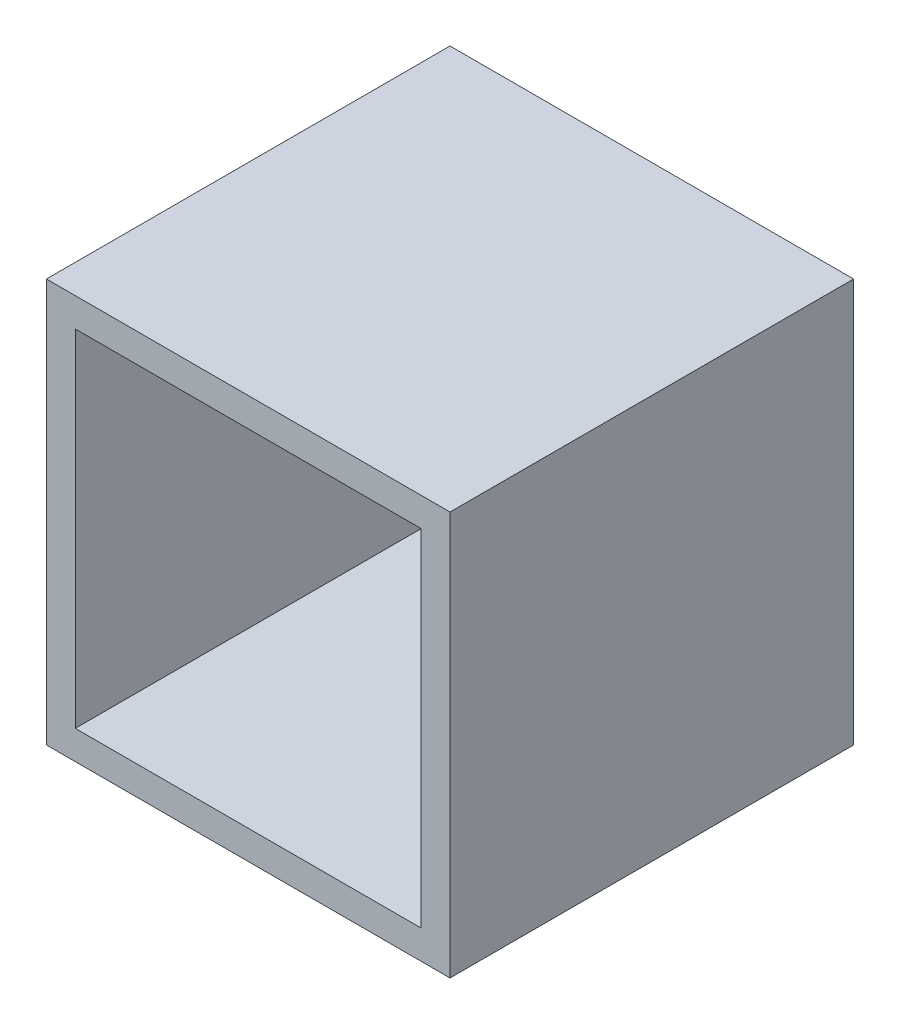
from build123d import *

# Parameters (mm, degrees)
SKETCH4_W           = 35
SKETCH4_H           = 35
BOSS_EXTRUDE2_DEPTH = 35
SKETCH5_OUTSIDE_W   = 49.124
SKETCH5_OUTSIDE_H   = 49.124
SKETCH5_OUTSIDE_W_2 = 35
SKETCH5_OUTSIDE_H_2 = 35
SKETCH5_OUTSIDE_W_3 = 30
SKETCH5_OUTSIDE_H_3 = 30
CUT_EXTRUDE2_DEPTH  = 32.5


with BuildPart() as part:
    # Sketch4 → Boss-Extrude2 (new body)
    with BuildSketch(Plane.XY):
        with Locations((-2.784904398, 3.060708191)):
            Rectangle(SKETCH4_W, SKETCH4_H)
    extrude(amount=BOSS_EXTRUDE2_DEPTH)

    # Sketch5 outside → Cut-Extrude2 (cut)
    # profile 1 of 2: a face of its own
    with BuildSketch(Plane.XY.offset(35)):
        with Locations((-2.785, 3.061)):
            Rectangle(SKETCH5_OUTSIDE_W, SKETCH5_OUTSIDE_H)
        with Locations((-2.784904398, 3.060708191)):
            Rectangle(SKETCH5_OUTSIDE_W_2, SKETCH5_OUTSIDE_H_2, mode=Mode.SUBTRACT)
    # profile 2 of 2: a face of its own
    with BuildSketch(Plane.XY.offset(35)):
        with Locations((-2.784904398, 3.060708191)):
            Rectangle(SKETCH5_OUTSIDE_W_3, SKETCH5_OUTSIDE_H_3)
    extrude(amount=-CUT_EXTRUDE2_DEPTH, mode=Mode.SUBTRACT)


solid = part.part
